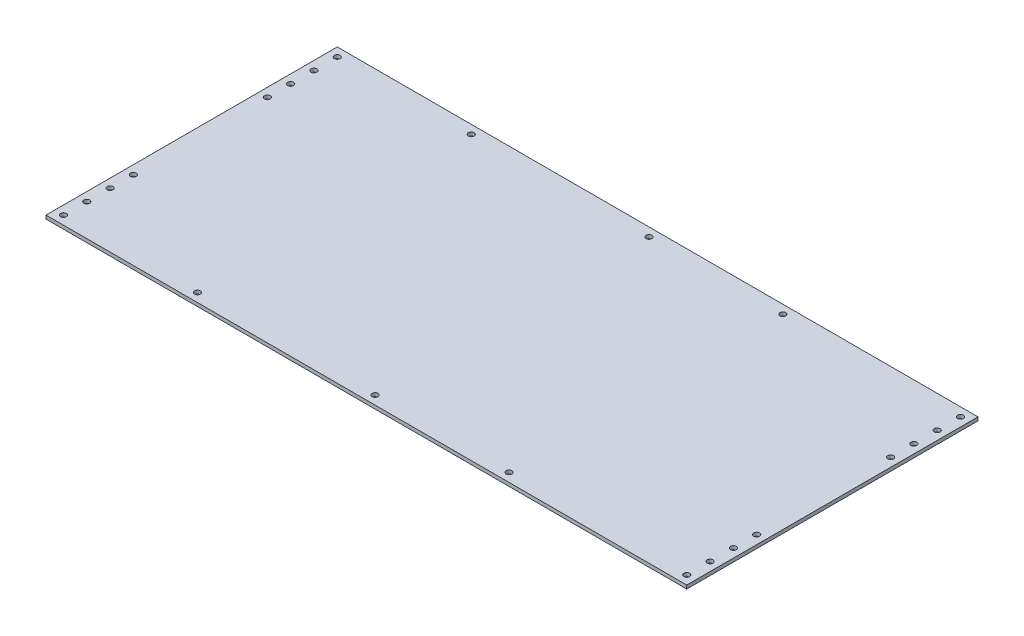
from build123d import *

# Parameters (mm, degrees)
SKETCH1_W           = 2200
SKETCH1_H           = 1000
SKETCH1_R           = 10
BOSS_EXTRUDE1_DEPTH = 12


with BuildPart() as part:
    # Sketch1 → Boss-Extrude1 (new body)
    with BuildSketch(Plane(origin=(0, 0, 0), x_dir=(1, 0, 0), z_dir=(0, 1, 0))):
        Rectangle(SKETCH1_W, SKETCH1_H)
        with Locations(Location((-1070, 470, 0), (0, 0, 270))):
            Circle(SKETCH1_R, mode=Mode.SUBTRACT)
        with Locations(Location((1070, 470, 0), (0, 0, 270))):
            Circle(SKETCH1_R, mode=Mode.SUBTRACT)
        with Locations(Location((1070, 230, 0), (0, 0, 270))):
            Circle(SKETCH1_R, mode=Mode.SUBTRACT)
        with Locations(Location((1070, 310, 0), (0, 0, 270))):
            Circle(SKETCH1_R, mode=Mode.SUBTRACT)
        with Locations(Location((1070, 390, 0), (0, 0, 270))):
            Circle(SKETCH1_R, mode=Mode.SUBTRACT)
        with Locations(Location((460, 470, 0), (0, 0, 270))):
            Circle(SKETCH1_R, mode=Mode.SUBTRACT)
        with Locations(Location((0, 470, 0), (0, 0, 270))):
            Circle(SKETCH1_R, mode=Mode.SUBTRACT)
        with Locations(Location((-610, 470, 0), (0, 0, 270))):
            Circle(SKETCH1_R, mode=Mode.SUBTRACT)
        with Locations(Location((-1070, 390, 0), (0, 0, 270))):
            Circle(SKETCH1_R, mode=Mode.SUBTRACT)
        with Locations(Location((-1070, 230, 0), (0, 0, 270))):
            Circle(SKETCH1_R, mode=Mode.SUBTRACT)
        with Locations(Location((-1070, 310, 0), (0, 0, 270))):
            Circle(SKETCH1_R, mode=Mode.SUBTRACT)
        with Locations(Location((1070, -230, 0), (0, 0, 90))):
            Circle(SKETCH1_R, mode=Mode.SUBTRACT)
        with Locations(Location((1070, -310, 0), (0, 0, 90))):
            Circle(SKETCH1_R, mode=Mode.SUBTRACT)
        with Locations(Location((1070, -390, 0), (0, 0, 90))):
            Circle(SKETCH1_R, mode=Mode.SUBTRACT)
        with Locations(Location((1070, -470, 0), (0, 0, 90))):
            Circle(SKETCH1_R, mode=Mode.SUBTRACT)
        with Locations(Location((460, -470, 0), (0, 0, 90))):
            Circle(SKETCH1_R, mode=Mode.SUBTRACT)
        with Locations(Location((0, -470, 0), (0, 0, 90))):
            Circle(SKETCH1_R, mode=Mode.SUBTRACT)
        with Locations(Location((-610, -470, 0), (0, 0, 90))):
            Circle(SKETCH1_R, mode=Mode.SUBTRACT)
        with Locations(Location((-1070, -470, 0), (0, 0, 90))):
            Circle(SKETCH1_R, mode=Mode.SUBTRACT)
        with Locations(Location((-1070, -390, 0), (0, 0, 90))):
            Circle(SKETCH1_R, mode=Mode.SUBTRACT)
        with Locations(Location((-1070, -310, 0), (0, 0, 90))):
            Circle(SKETCH1_R, mode=Mode.SUBTRACT)
        with Locations(Location((-1070, -230, 0), (0, 0, 90))):
            Circle(SKETCH1_R, mode=Mode.SUBTRACT)
    extrude(amount=-BOSS_EXTRUDE1_DEPTH)


solid = part.part
